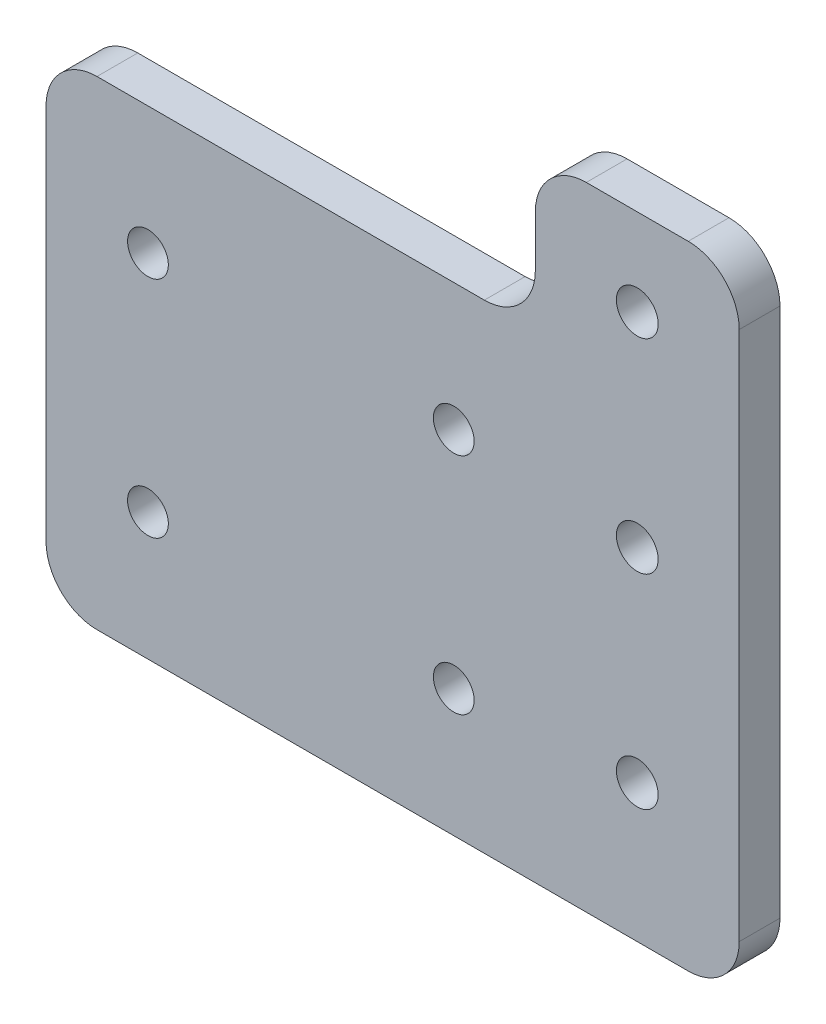
from build123d import *

# Parameters (mm, degrees)
SKETCH_1_W          = 68
SKETCH_1_H          = 47
EXTRUDE_1_DEPTH     = 4
SKETCH_2_R          = 2
SKETCH_2_R_2        = 2.05
CUT_EXTRUDE_1_DEPTH = 4
SKETCH_5_W          = 20
SKETCH_5_H          = 15
EXTRUDE_3_DEPTH     = 4
SKETCH_6_R          = 2.05
CUT_EXTRUDE_3_DEPTH = 12
FILLET_3_R          = 5


with BuildPart() as part:
    # 草图1 → 凸台-拉伸1 (new body)
    with BuildSketch(Plane.XY):
        with Locations((34, 23.5)):
            Rectangle(SKETCH_1_W, SKETCH_1_H)
    extrude(amount=EXTRUDE_1_DEPTH)

    # 草图2 → 切除-拉伸1 (cut)
    with BuildSketch(Plane.XY.offset(4)):
        with Locations((10, 34.5)):
            Circle(SKETCH_2_R)
        with Locations(Location((10, 12.5, 0), (0, 0, 180))):
            Circle(SKETCH_2_R)
        with Locations((40, 34.5)):
            Circle(SKETCH_2_R)
        with Locations(Location((40, 12.5, 0), (0, 0, 180))):
            Circle(SKETCH_2_R)
        with Locations((58, 33.5)):
            Circle(SKETCH_2_R_2)
        with Locations(Location((58, 13.5, 0), (0, 0, 180))):
            Circle(SKETCH_2_R_2)
    extrude(amount=-CUT_EXTRUDE_1_DEPTH, mode=Mode.SUBTRACT)

    # 草图5 → 凸台-拉伸3 (add)
    with BuildSketch(Plane.XY.offset(4)):
        with Locations((58, 54.5)):
            Rectangle(SKETCH_5_W, SKETCH_5_H)
    extrude(amount=-EXTRUDE_3_DEPTH)

    # 草图6 → 切除-拉伸3 (cut)
    with BuildSketch(Plane.XY.offset(4)):
        with Locations((58, 33.5)):
            Circle(SKETCH_6_R)
        with Locations((58, 53.5)):
            Circle(SKETCH_6_R)
    extrude(amount=-CUT_EXTRUDE_3_DEPTH, mode=Mode.SUBTRACT)

    # 圆角3
    fillet_3_edges = [part.edges().sort_by_distance(p)[0] for p in [
        (68, 62, 2),
        (48, 47, 2),
        (48, 62, 2),
        (0, 47, 2),
        (68, 0, 2),
        (0, 0, 2),
    ]]
    fillet(fillet_3_edges, radius=FILLET_3_R)


solid = part.part
